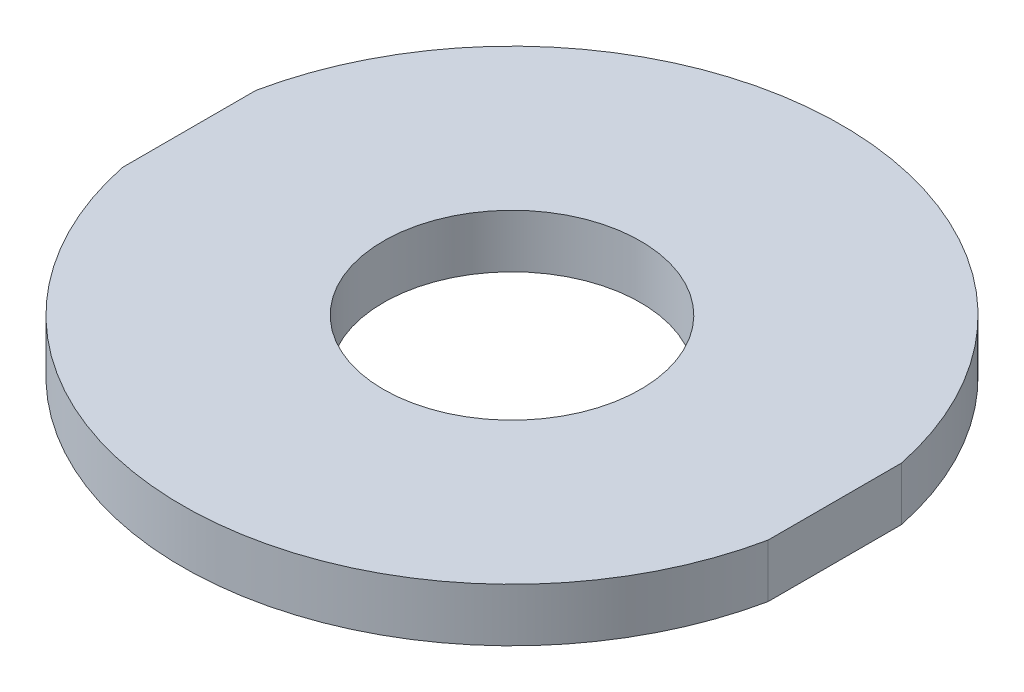
from build123d import *

# Parameters (mm, degrees)
SKETCH1_R           = 24.116
BOSS_EXTRUDE1_DEPTH = 10


with BuildPart() as part:
    # Sketch1 → Boss-Extrude1 (new body)
    with BuildSketch(Plane(origin=(0, 0, 0), x_dir=(0.9995179941195829, 0, 0.03104479716741388), z_dir=(0, 1, 0))):
        with BuildLine():
            Line((-90.290454988, 8.003154584), (-89.514335059, -16.984795269))
            ThreePointArc((-89.514335059, -16.984795269), (-27.472473835, -64.398578188), (31.50731448, -13.225890892))
            Line((31.50731448, -13.225890892), (30.731194551, 11.762058961))
            ThreePointArc((30.731194551, 11.762058961), (-31.310666673, 59.17584188), (-90.290454988, 8.003154584))
        make_face()
        with Locations(Location((-29.391570254, -2.611368154, 0), (0, 0, 271.779021696))):
            Circle(SKETCH1_R, mode=Mode.SUBTRACT)
    extrude(amount=BOSS_EXTRUDE1_DEPTH)


solid = part.part
